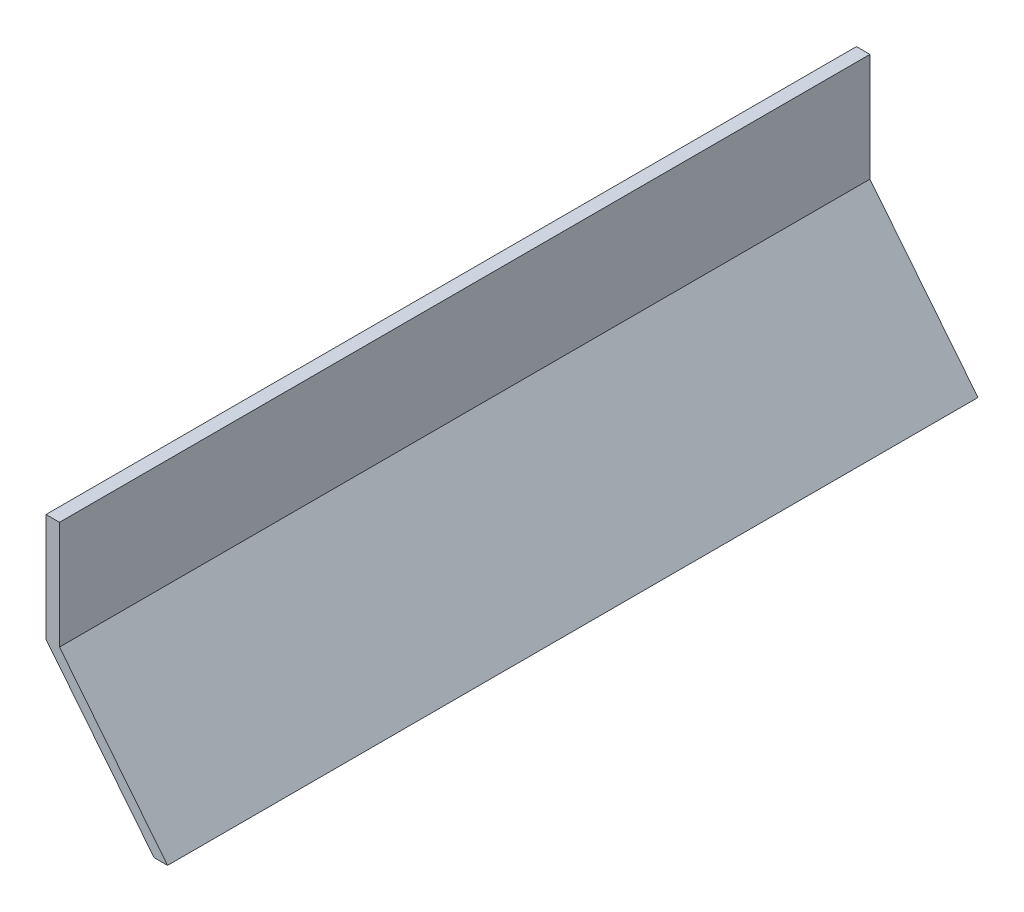
from build123d import *

# Parameters (mm, degrees)
EXTRUDE_1_DEPTH = 30


with BuildPart() as part:
    # 草圖1 → 填料-伸長1 (new body)
    with BuildSketch(Plane.XY):
        Polygon((0, 0), (0, 4), (0.5, 4), (0.5, 0), (4.5, -5), (4, -5), align=None)
    extrude(amount=EXTRUDE_1_DEPTH)


solid = part.part
